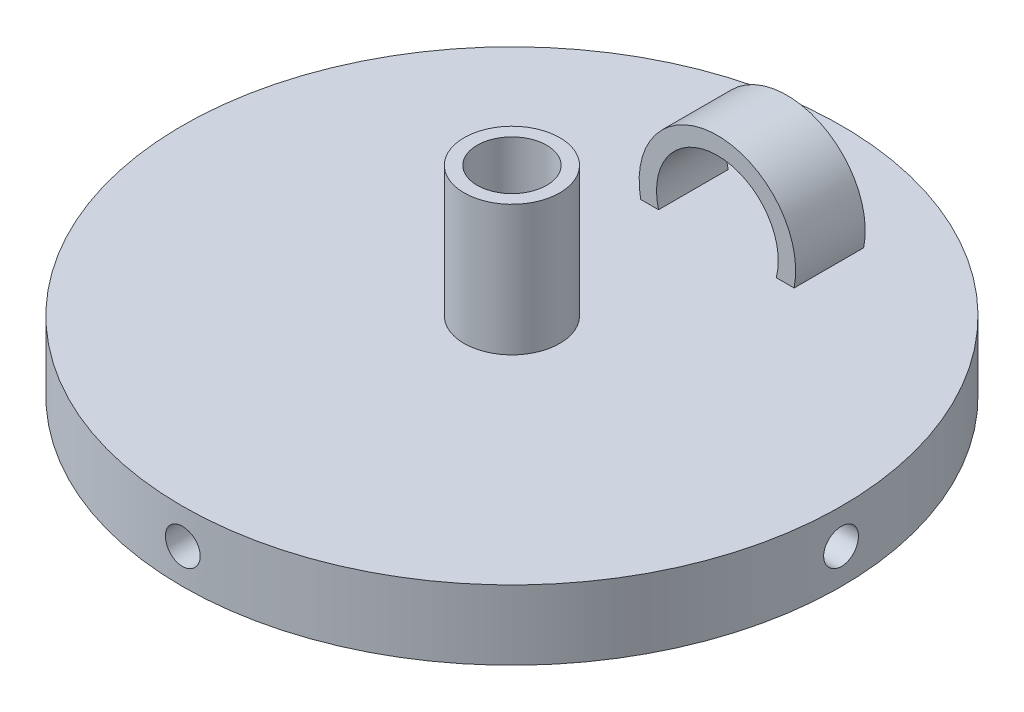
from build123d import *

# Parameters (mm, degrees)
SKETCH1_R           = 37.9
BOSS_EXTRUDE1_DEPTH = 8
CUT_EXTRUDE2_REACH  = 56.192
SKETCH2_R           = 2
SKETCH4_R           = 5.5
SKETCH4_R_2         = 4
BOSS_EXTRUDE2_DEPTH = 15
BOSS_EXTRUDE5_DEPTH = 4
SKETCH9_R           = 2
CUT_EXTRUDE3_DEPTH  = 9
SKETCH10_R          = 2
CUT_EXTRUDE4_DEPTH  = 9
CUT_EXTRUDE5_START  = -9
SKETCH11_R          = 2
CUT_EXTRUDE5_DEPTH  = 9
CUT_EXTRUDE6_START  = -9
SKETCH12_R          = 2
CUT_EXTRUDE6_DEPTH  = 9


with BuildPart() as part:
    # Sketch1 → Boss-Extrude1 (new body)
    with BuildSketch(Plane(origin=(0, 0, 0), x_dir=(1, 0, 0), z_dir=(0, 1, 0))):
        Circle(SKETCH1_R)
    extrude(amount=BOSS_EXTRUDE1_DEPTH)

    # Sketch2 → Cut-Extrude2 (cut, up to next)
    with BuildSketch(Plane(origin=(0, 8, 0), x_dir=(1, 0, 0), z_dir=(0, 1, 0)), mode=Mode.PRIVATE) as cut_extrude2_sk1:
        Circle(SKETCH2_R)
    cut_extrude2_tool1 = extrude(cut_extrude2_sk1.sketch, amount=-CUT_EXTRUDE2_REACH, mode=Mode.PRIVATE) & part.part
    add(cut_extrude2_tool1.solids().sort_by_distance((0, 8, 0))[0], mode=Mode.SUBTRACT)

    # Sketch4 → Boss-Extrude2 (add)
    with BuildSketch(Plane(origin=(0, 8, 0), x_dir=(1, 0, 0), z_dir=(0, 1, 0))):
        Circle(SKETCH4_R)
        Circle(SKETCH4_R_2, mode=Mode.SUBTRACT)
    extrude(amount=BOSS_EXTRUDE2_DEPTH)

    # Sketch9 → Cut-Extrude3 (cut)
    with BuildSketch(Plane(origin=(0, 0, -37.9), x_dir=(-1, 0, 0), z_dir=(0, 0, -1))):
        with Locations((0, 4)):
            Circle(SKETCH9_R)
    extrude(amount=-CUT_EXTRUDE3_DEPTH, mode=Mode.SUBTRACT)

    # Sketch10 → Cut-Extrude4 (cut)
    with BuildSketch(Plane(origin=(37.9, 0, 0), x_dir=(0, 0, -1), z_dir=(1, 0, 0))):
        with Locations((0, 4)):
            Circle(SKETCH10_R)
    extrude(amount=-CUT_EXTRUDE4_DEPTH, mode=Mode.SUBTRACT)

    # Sketch11 → Cut-Extrude5 (cut)
    with BuildSketch(Plane.XY.offset(37.9).offset(CUT_EXTRUDE5_START)):
        with Locations((0, 4)):
            Circle(SKETCH11_R)
    extrude(amount=CUT_EXTRUDE5_DEPTH, mode=Mode.SUBTRACT)

    # Sketch12 → Cut-Extrude6 (cut)
    with BuildSketch(Plane.ZY.offset(37.9).offset(CUT_EXTRUDE6_START)):
        with Locations((0, 4)):
            Circle(SKETCH12_R)
    extrude(amount=CUT_EXTRUDE6_DEPTH, mode=Mode.SUBTRACT)


with BuildPart() as body_2:
    # Sketch8 → Boss-Extrude5 (new, symmetric)
    with BuildSketch(Plane.XY.offset(-23)):
        with BuildLine():
            ThreePointArc((13.627844773, 9.792220599), (3.727213653, 18.747044081), (-4.191902691, 8))
            Line((-4.191902691, 8), (-2.138834274, 8))
            ThreePointArc((-2.138834274, 8), (3.724172633, 16.733645285), (11.627844773, 9.792220599))
            ThreePointArc((11.627844773, 9.792220599), (11.569269458, 8.88854846), (11.39452382, 8))
            Line((11.39452382, 8), (13.447592237, 8))
            ThreePointArc((13.447592237, 8), (13.582668254, 8.89158948), (13.627844773, 9.792220599))
        make_face()
    extrude(amount=BOSS_EXTRUDE5_DEPTH, both=True)


solid = Compound([part.part, body_2.part])
